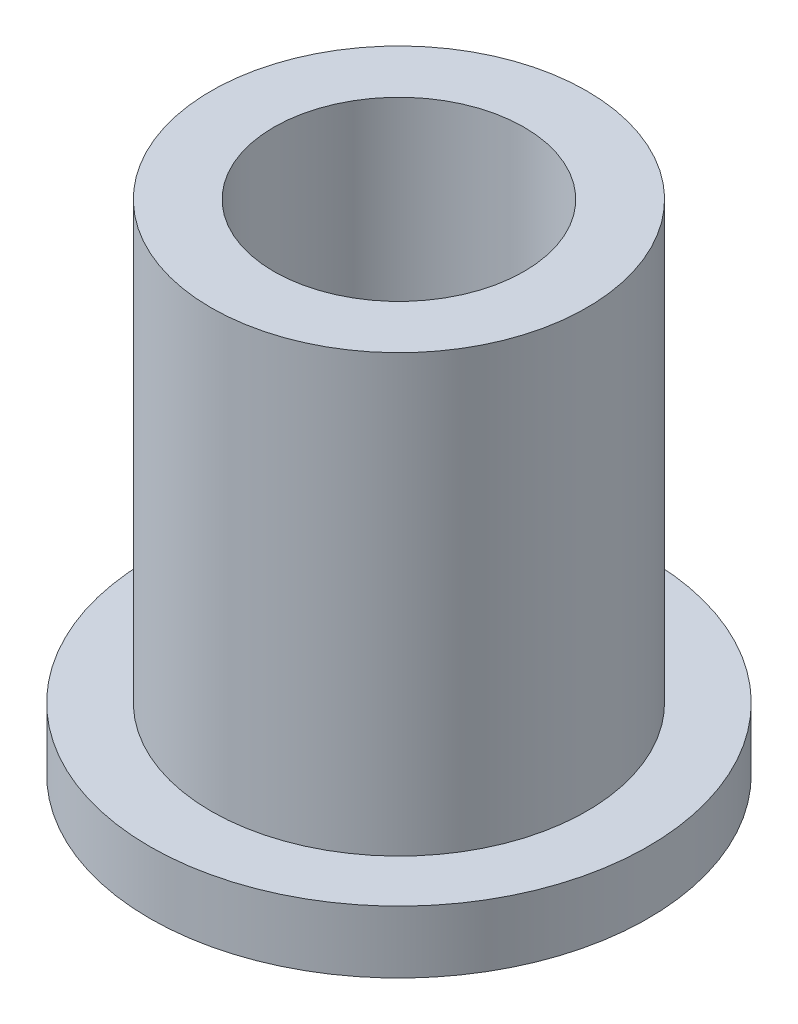
from build123d import *

# Parameters (mm, degrees)
SKETCH2_R           = 4.7879
SKETCH2_R_2         = 3.1877
BOSS_EXTRUDE1_DEPTH = 12.7
SKETCH3_R           = 6.35
SKETCH3_R_2         = 4.7879
BOSS_EXTRUDE2_DEPTH = 1.5875


with BuildPart() as part:
    # Sketch2 → Boss-Extrude1 (new body)
    with BuildSketch(Plane(origin=(0, 0, 0), x_dir=(1, 0, 0), z_dir=(0, 1, 0))):
        with Locations(Location((0, 0, 0), (0, 0, 270))):
            Circle(SKETCH2_R)
        with Locations(Location((0, 0, 0), (0, 0, 270))):
            Circle(SKETCH2_R_2, mode=Mode.SUBTRACT)
    extrude(amount=BOSS_EXTRUDE1_DEPTH)

    # Sketch3 → Boss-Extrude2 (add)
    with BuildSketch(Plane(origin=(0, 0, 0), x_dir=(1, 0, 0), z_dir=(0, 1, 0))):
        with Locations(Location((0, 0, 0), (0, 0, 270))):
            Circle(SKETCH3_R)
        with Locations(Location((0, 0, 0), (0, 0, 270))):
            Circle(SKETCH3_R_2, mode=Mode.SUBTRACT)
    extrude(amount=BOSS_EXTRUDE2_DEPTH)


solid = part.part
